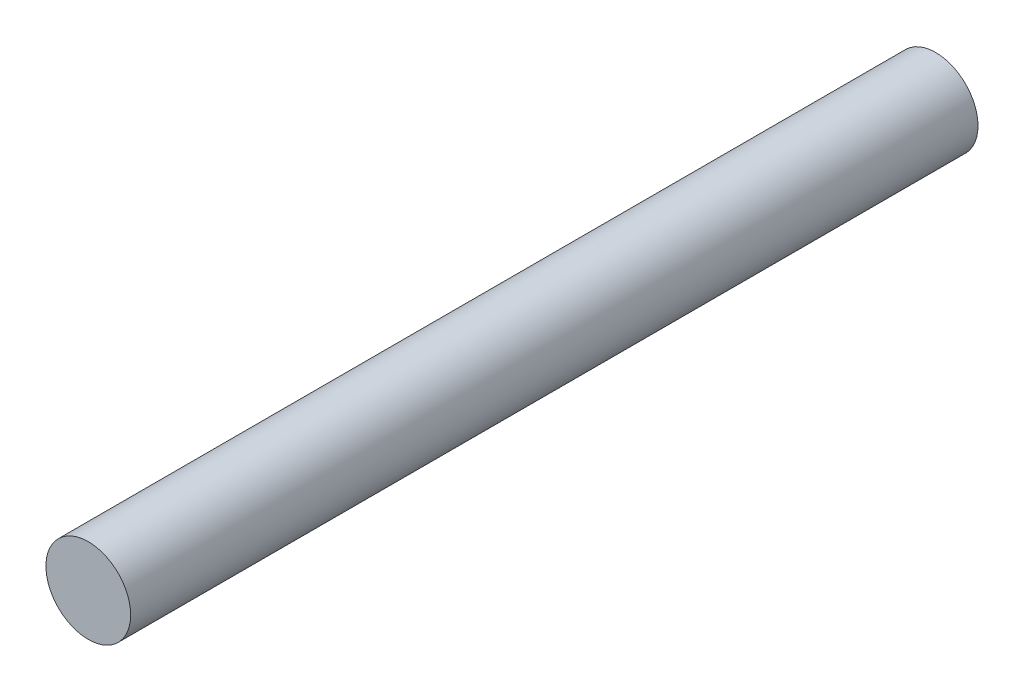
from build123d import *

# Parameters (mm, degrees)
SKETCH_1_R      = 1
EXTRUDE_1_DEPTH = 20


with BuildPart() as part:
    # 草图1 → 凸台-拉伸1 (new body)
    with BuildSketch(Plane.XY):
        Circle(SKETCH_1_R)
    extrude(amount=EXTRUDE_1_DEPTH)


solid = part.part
